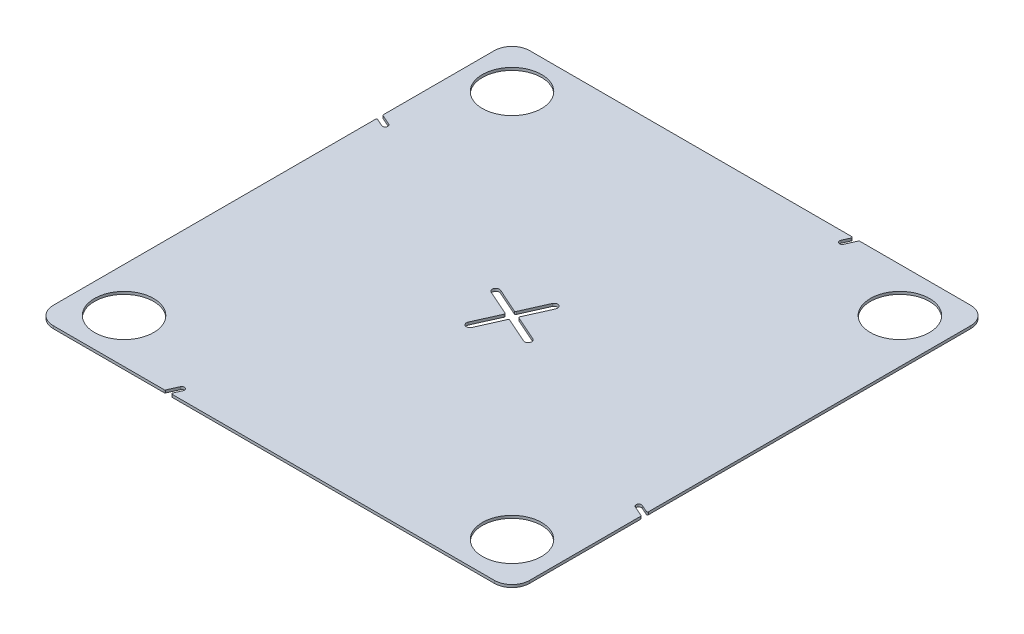
from build123d import *

# Parameters (mm, degrees)
SKETCH1_W           = 341.884
SKETCH1_H           = 341.884
BOSS_EXTRUDE1_DEPTH = 1.89738
SKETCH2_R           = 21.209
CUT_EXTRUDE1_DEPTH  = 242.755940524
FILLET2_R           = 12.7
CUT_EXTRUDE3_DEPTH  = 242.755940524
FILLET3_R           = 0.762


with BuildPart() as part:
    # Sketch1 → Boss-Extrude1 (new body)
    with BuildSketch(Plane(origin=(0, 0, 0), x_dir=(1, 0, 0), z_dir=(0, 1, 0))):
        Rectangle(SKETCH1_W, SKETCH1_H)
    extrude(amount=BOSS_EXTRUDE1_DEPTH)

    # Sketch2 → Cut-Extrude1 (cut, through all)
    with BuildSketch(Plane(origin=(0, 1.89738, 0), x_dir=(1, 0, 0), z_dir=(0, 1, 0))):
        with Locations(Location((-139.192, -139.192, 0), (0, 0, 270))):
            Circle(SKETCH2_R)
        with Locations(Location((-139.192, 139.192, 0), (0, 0, 270))):
            Circle(SKETCH2_R)
        with Locations(Location((139.192, 139.192, 0), (0, 0, 270))):
            Circle(SKETCH2_R)
        with Locations(Location((139.192, -139.192, 0), (0, 0, 270))):
            Circle(SKETCH2_R)
    extrude(amount=-CUT_EXTRUDE1_DEPTH, mode=Mode.SUBTRACT)

    # Fillet2
    fillet2_edges = [part.edges().sort_by_distance(p)[0] for p in [
        (-170.942, 0.94869, -170.942),
        (170.942, 0.94869, -170.942),
        (170.942, 0.94869, 170.942),
        (-170.942, 0.94869, 170.942),
    ]]
    fillet(fillet2_edges, radius=FILLET2_R)

    # Sketch6 → Cut-Extrude3 (cut, through all)
    with BuildSketch(Plane(origin=(0, 1.89738, 0), x_dir=(1, 0, 0), z_dir=(0, 1, 0))):
        with BuildLine():
            Line((6.977594198, 21.916760235), (-1.287294389, 3.353516536))
            Line((-1.287294389, 3.353516536), (-19.850538088, 11.618405123))
            ThreePointArc((-19.850538088, 11.618405123), (-23.204054624, 10.331110734), (-21.916760235, 6.977594198))
            Line((-21.916760235, 6.977594198), (-3.353516536, -1.287294389))
            Line((-3.353516536, -1.287294389), (-11.618405123, -19.850538088))
            ThreePointArc((-11.618405123, -19.850538088), (-10.331110734, -23.204054624), (-6.977594198, -21.916760235))
            Line((-6.977594198, -21.916760235), (1.287294389, -3.353516536))
            Line((1.287294389, -3.353516536), (19.850538088, -11.618405123))
            ThreePointArc((19.850538088, -11.618405123), (23.204054624, -10.331110734), (21.916760235, -6.977594198))
            Line((21.916760235, -6.977594198), (3.353516536, 1.287294389))
            Line((3.353516536, 1.287294389), (11.618405123, 19.850538088))
            ThreePointArc((11.618405123, 19.850538088), (10.331110734, 23.204054624), (6.977594198, 21.916760235))
        make_face()
        with BuildLine():
            Line((-170.942, 78.193564035), (-163.205950308, 74.749252801))
            ThreePointArc((-163.205950308, 74.749252801), (-162.240479516, 72.234115399), (-164.755616918, 71.268644607))
            Line((-164.755616918, 71.268644607), (-170.942, 74.022999813))
            Line((-170.942, 74.022999813), (-170.942, 78.193564035))
        make_face()
        with BuildLine():
            Line((74.022999813, 170.942), (78.193564035, 170.942))
            Line((78.193564035, 170.942), (74.749252801, 163.205950308))
            ThreePointArc((74.749252801, 163.205950308), (72.234115399, 162.240479516), (71.268644607, 164.755616918))
            Line((71.268644607, 164.755616918), (74.022999813, 170.942))
        make_face()
        with BuildLine():
            Line((170.942, -74.022999813), (170.942, -78.193564035))
            Line((170.942, -78.193564035), (163.205950308, -74.749252801))
            ThreePointArc((163.205950308, -74.749252801), (162.240479516, -72.234115399), (164.755616918, -71.268644607))
            Line((164.755616918, -71.268644607), (170.942, -74.022999813))
        make_face()
        with BuildLine():
            Line((-74.022999813, -170.942), (-78.193564035, -170.942))
            Line((-78.193564035, -170.942), (-74.749252801, -163.205950308))
            ThreePointArc((-74.749252801, -163.205950308), (-72.234115399, -162.240479516), (-71.268644607, -164.755616918))
            Line((-71.268644607, -164.755616918), (-74.022999813, -170.942))
        make_face()
    extrude(amount=-CUT_EXTRUDE3_DEPTH, mode=Mode.SUBTRACT)

    # Fillet3
    fillet3_edges = [part.edges().sort_by_distance(p)[0] for p in [
        (78.193564035, 0.94869, -170.942),
        (74.022999813, 0.94869, -170.942),
        (-170.942, 0.94869, -74.022999813),
        (-170.942, 0.94869, -78.193564035),
        (3.353516536, 0.94869, -1.287294389),
        (1.287294389, 0.94869, 3.353516536),
        (-3.353516536, 0.94869, 1.287294389),
        (-1.287294389, 0.94869, -3.353516536),
        (-78.193564035, 0.94869, 170.942),
        (-74.022999813, 0.94869, 170.942),
        (170.942, 0.94869, 78.193564035),
        (170.942, 0.94869, 74.022999813),
    ]]
    fillet(fillet3_edges, radius=FILLET3_R)


solid = part.part
